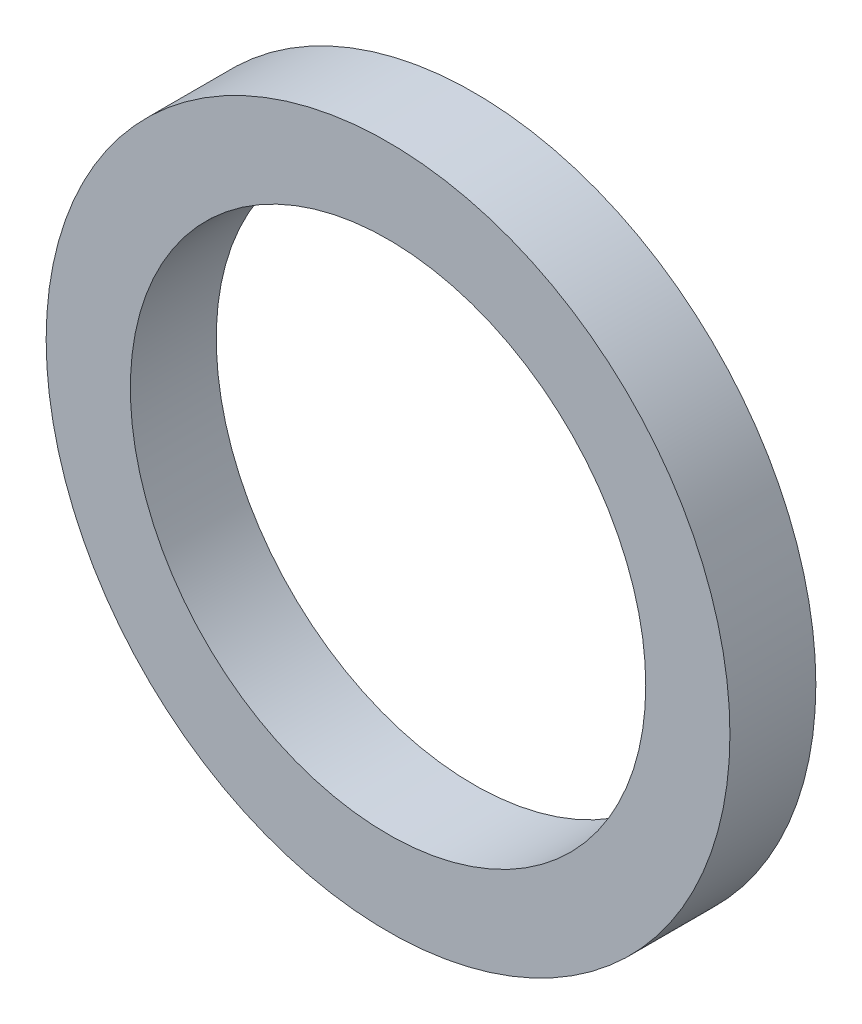
from build123d import *

# Parameters (mm, degrees)
SKETCH1_R           = 25.273
BOSS_EXTRUDE1_DEPTH = 6.35
SKETCH2_R           = 19.05
CUT_EXTRUDE1_DEPTH  = 37.301123371


with BuildPart() as part:
    # Sketch1 → Boss-Extrude1 (new body)
    with BuildSketch(Plane.XY):
        Circle(SKETCH1_R)
    extrude(amount=BOSS_EXTRUDE1_DEPTH)

    # Sketch2 → Cut-Extrude1 (cut, through all)
    with BuildSketch(Plane.XY.offset(6.35)):
        Circle(SKETCH2_R)
    extrude(amount=-CUT_EXTRUDE1_DEPTH, mode=Mode.SUBTRACT)


solid = part.part
